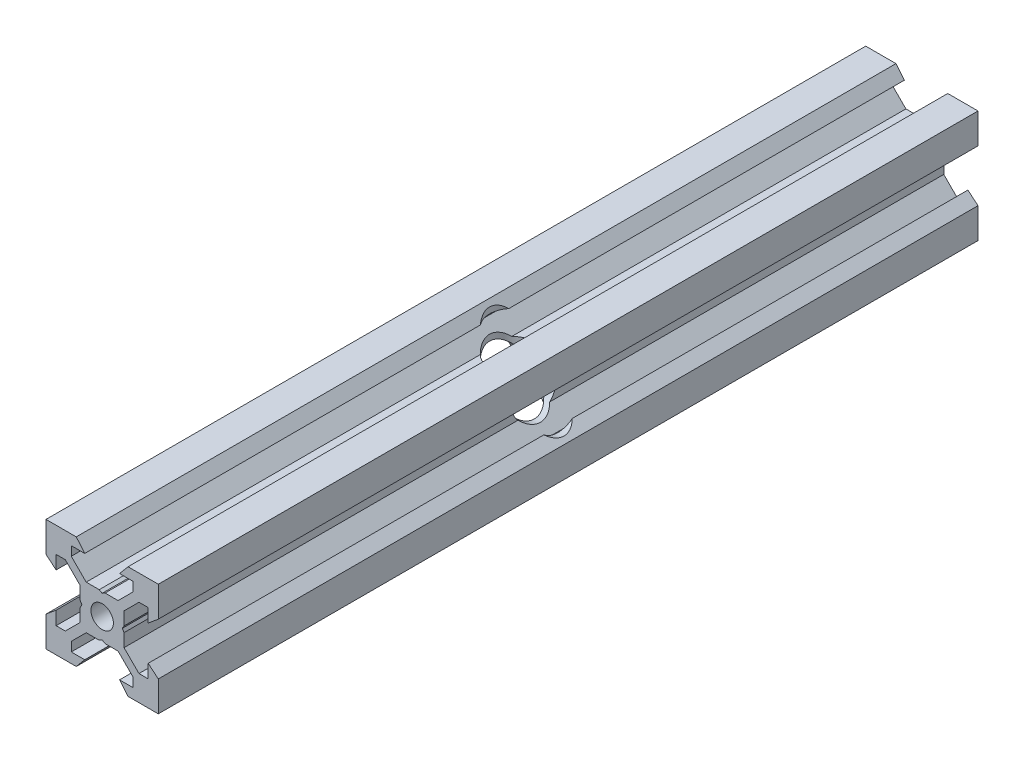
from build123d import *

# Parameters (mm, degrees)
SKETCH1_R               = 2
BOSS_EXTRUDE1_DEPTH     = 146
CUT_EXTRUDE1_DEPTH      = 147.683332386
CUT_EXTRUDE1_DEPTH_BACK = 147.683332386
SKETCH4_R               = 4
CUT_EXTRUDE2_DEPTH      = 147.683332486
CUT_EXTRUDE2_DEPTH_BACK = 147.683332486
SKETCH5_R               = 4


with BuildPart() as part:
    # Sketch1 → Boss-Extrude1 (new body)
    with BuildSketch(Plane.XY):
        Polygon((10, 10), (10, 4.610379336), (8.2, 3.1), (8.2, 5.5), (6.560660172, 5.5), (3.9, 2.839339828), (3.9, 0.519615242), (3.6, 0), (3.9, -0.519615242), (3.9, -2.839339828), (6.560660172, -5.5), (8.2, -5.5), (8.2, -3.1), (10, -4.610379336), (10, -10), (4.610379336, -10), (3.1, -8.2), (5.5, -8.2), (5.5, -6.560660172), (2.839339828, -3.9), (0.519615242, -3.9), (0, -3.6), (-0.519615242, -3.9), (-2.839339828, -3.9), (-5.5, -6.560660172), (-5.5, -8.2), (-3.1, -8.2), (-4.610379336, -10), (-10, -10), (-10, -4.610379336), (-8.2, -3.1), (-8.2, -5.5), (-6.560660172, -5.5), (-3.9, -2.839339828), (-3.9, -0.519615242), (-3.6, 0), (-3.9, 0.519615242), (-3.9, 2.839339828), (-6.560660172, 5.5), (-8.2, 5.5), (-8.2, 3.1), (-10, 4.610379336), (-10, 10), (-4.610379336, 10), (-3.1, 8.2), (-5.5, 8.2), (-5.5, 6.560660172), (-2.839339828, 3.9), (-0.519615242, 3.9), (0, 3.6), (0.519615242, 3.9), (2.839339828, 3.9), (5.5, 6.560660172), (5.5, 8.2), (3.1, 8.2), (4.610379336, 10), align=None)
        Circle(SKETCH1_R, mode=Mode.SUBTRACT)
    extrude(amount=BOSS_EXTRUDE1_DEPTH)

    # Sketch4 → Cut-Extrude1 (cut, two sides: drawn at the far end of the back side and taken through both)
    with BuildSketch(Plane(origin=(0, 0, 0), x_dir=(0, 0, -1), z_dir=(1, 0, 0)).offset(-CUT_EXTRUDE1_DEPTH_BACK)):
        with Locations((-73, 0)):
            Circle(SKETCH4_R)
    extrude(amount=CUT_EXTRUDE1_DEPTH + CUT_EXTRUDE1_DEPTH_BACK, mode=Mode.SUBTRACT)

    # Sketch5 → Cut-Extrude2 (cut, two sides: drawn at the far end of the back side and taken through both)
    with BuildSketch(Plane(origin=(0, 0, 0), x_dir=(1, 0, 0), z_dir=(0, 1, 0)).offset(-CUT_EXTRUDE2_DEPTH_BACK)):
        with Locations(Location((0, -73, 0), (0, 0, 270))):
            Circle(SKETCH5_R)
    extrude(amount=CUT_EXTRUDE2_DEPTH + CUT_EXTRUDE2_DEPTH_BACK, mode=Mode.SUBTRACT)


solid = part.part
